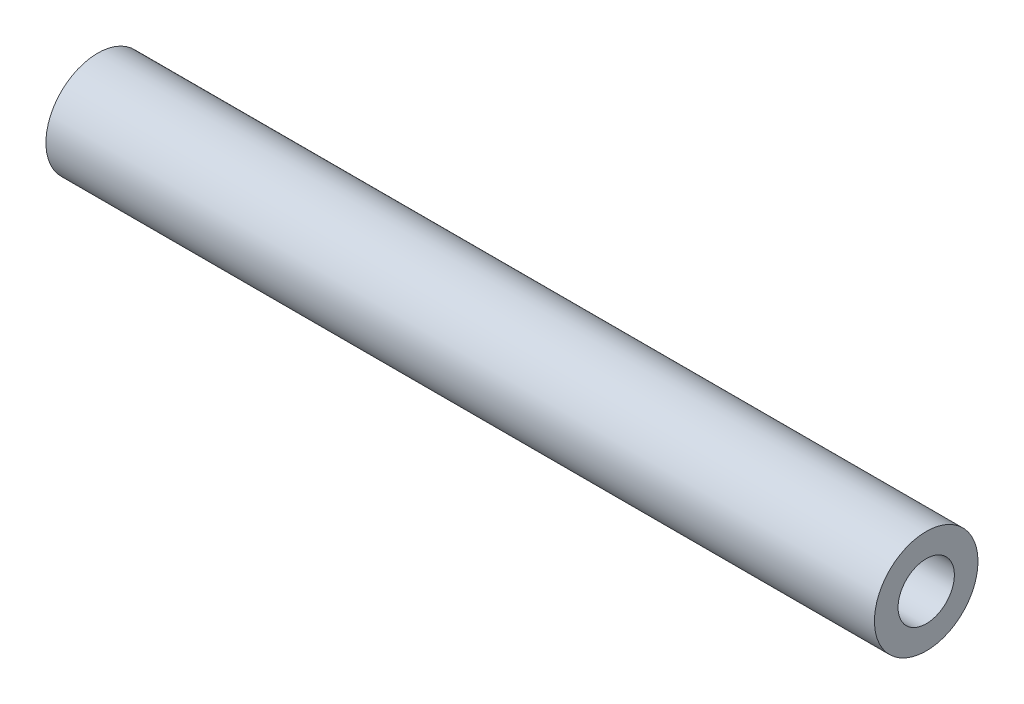
from build123d import *

# Parameters (mm, degrees)
SKETCH1_R                 = 3.175
BOSS_EXTRUDE1_DEPTH       = 50.8
F_8_32_TAPPED_HOLE1_D     = 3.4544
F_8_32_TAPPED_HOLE1_DEPTH = 25.4
F_8_32_TAPPED_HOLE1_TIP   = 1.037806461


with BuildPart() as part:
    # Sketch1 → Boss-Extrude1 (new body)
    with BuildSketch(Plane(origin=(0, 0, 0), x_dir=(0, 0, -1), z_dir=(1, 0, 0))):
        Circle(SKETCH1_R)
    extrude(amount=BOSS_EXTRUDE1_DEPTH)

    # #8-32 Tapped Hole1
    with Locations(Plane(origin=(50.8, 0, 0), x_dir=(0, 0, -1), z_dir=(1, 0, 0))):
        with Locations((0, 0)):
            Hole(F_8_32_TAPPED_HOLE1_D / 2, depth=F_8_32_TAPPED_HOLE1_DEPTH)
            with Locations((0, 0, -(F_8_32_TAPPED_HOLE1_DEPTH + F_8_32_TAPPED_HOLE1_TIP / 2))):  # 118° drill point
                Cone(0, F_8_32_TAPPED_HOLE1_D / 2, F_8_32_TAPPED_HOLE1_TIP, mode=Mode.SUBTRACT)


solid = part.part
